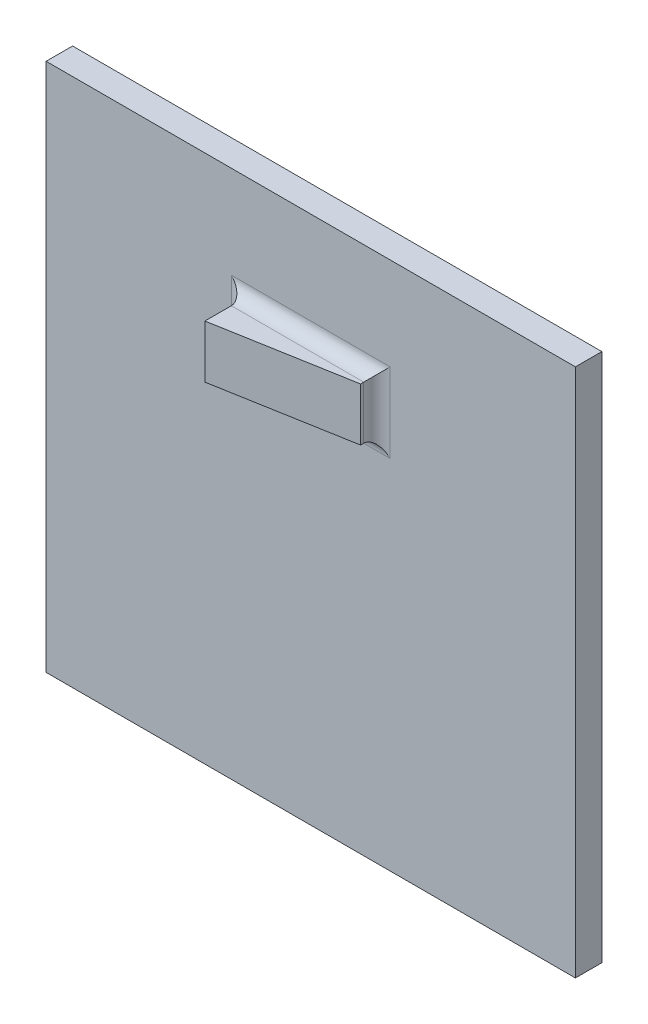
from build123d import *

# Parameters (mm, degrees)
SKETCH_1_W          = 40
SKETCH_1_H          = 20
EXTRUDE_1_DEPTH     = 2
SKETCH_2_W          = 10
SKETCH_2_H          = 4
EXTRUDE_2_DEPTH     = 3
CUT_EXTRUDE_1_REACH = 25.854
SKETCH_4_W          = 40
SKETCH_4_H          = 2
EXTRUDE_3_DEPTH     = 20
FILLET_1_R          = 1


with BuildPart() as part:
    # 草图1 → 凸台-拉伸1 (new body)
    with BuildSketch(Plane.XY):
        Rectangle(SKETCH_1_W, SKETCH_1_H)
    extrude(amount=EXTRUDE_1_DEPTH)

    # 草图2 → 凸台-拉伸2 (add)
    with BuildSketch(Plane.XY.offset(2)):
        Rectangle(SKETCH_2_W, SKETCH_2_H)
    extrude(amount=EXTRUDE_2_DEPTH)

    # 草图3 → 切除-拉伸1 (cut, up to next)
    with BuildSketch(Plane.XZ.offset(2), mode=Mode.PRIVATE) as cut_extrude_1_sk1:
        Polygon((-5, 5), (5, 3.236730193), (5, 5), align=None)
    cut_extrude_1_tool1 = extrude(cut_extrude_1_sk1.sketch, amount=-CUT_EXTRUDE_1_REACH, mode=Mode.PRIVATE) & part.part
    add(cut_extrude_1_tool1.solids().sort_by_distance((1.666667, -2, 4.412243))[0], mode=Mode.SUBTRACT)

    # 草图4 → 凸台-拉伸3 (add)
    with BuildSketch(Plane.XZ.offset(10)):
        with Locations((0, 1)):
            Rectangle(SKETCH_4_W, SKETCH_4_H)
    extrude(amount=EXTRUDE_3_DEPTH)

    # 圆角1
    fillet_1_edges = [part.edges().sort_by_distance(p)[0] for p in [
        (5, 0, 2),
        (0, 2, 2),
        (-5, 0, 2),
        (0, -2, 2),
    ]]
    fillet(fillet_1_edges, radius=FILLET_1_R)


solid = part.part
